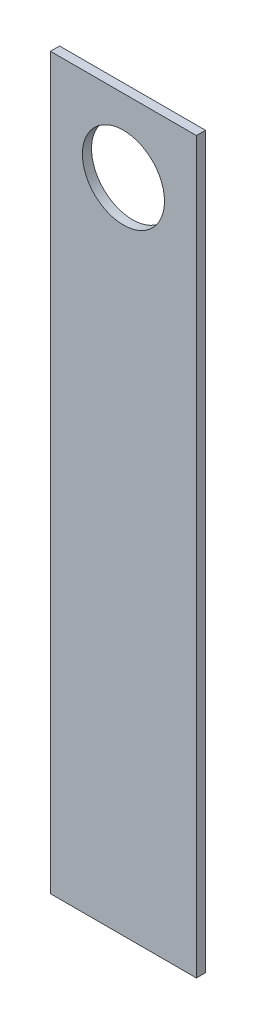
from build123d import *

# Parameters (mm, degrees)
SKETCH1_W           = 50.8
SKETCH1_H           = 254
SKETCH1_R           = 14.2875
BOSS_EXTRUDE1_DEPTH = 3.175


with BuildPart() as part:
    # Sketch1 → Boss-Extrude1 (new body)
    with BuildSketch(Plane.XY):
        with Locations((25.4, 127)):
            Rectangle(SKETCH1_W, SKETCH1_H)
        with Locations((25.4, 228.6)):
            Circle(SKETCH1_R, mode=Mode.SUBTRACT)
    extrude(amount=BOSS_EXTRUDE1_DEPTH)


solid = part.part
